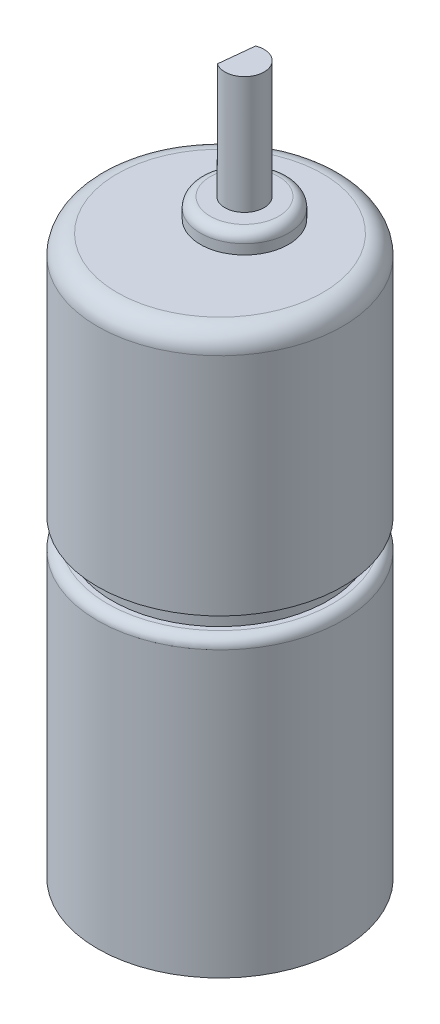
from build123d import *

# Parameters (mm, degrees)
SKETCH1_R           = 12.5
BOSS_EXTRUDE1_DEPTH = 25
SKETCH2_R           = 11
BOSS_EXTRUDE2_DEPTH = 2
BOSS_EXTRUDE3_START = 30
SKETCH3_R           = 12.5
BOSS_EXTRUDE3_DEPTH = 30
SKETCH4_R           = 4.5
BOSS_EXTRUDE4_DEPTH = 2
FILLET1_R           = 2
FILLET2_R           = 1
FILLET3_R           = 1
SKETCH5_R           = 2
BOSS_EXTRUDE5_DEPTH = 12
CUT_EXTRUDE1_START  = -9
CUT_EXTRUDE1_DEPTH  = 9


with BuildPart() as part:
    # Sketch1 → Boss-Extrude1 (new body)
    with BuildSketch(Plane(origin=(0, 0, 0), x_dir=(1, 0, 0), z_dir=(0, 1, 0))):
        with Locations(Location((0, 0, 0), (0, 0, 270))):
            Circle(SKETCH1_R)
    extrude(amount=BOSS_EXTRUDE1_DEPTH)

    # Sketch2 → Boss-Extrude2 (add)
    with BuildSketch(Plane.XZ):
        with Locations(Location((0, 0, 0), (0, 0, 270))):
            Circle(SKETCH2_R)
    extrude(amount=BOSS_EXTRUDE2_DEPTH)

    # Sketch3 → Boss-Extrude3 (add)
    with BuildSketch(Plane.XZ.offset(2).offset(BOSS_EXTRUDE3_START)):
        with Locations(Location((0, 0, 0), (0, 0, 90))):
            Circle(SKETCH3_R)
    extrude(amount=-BOSS_EXTRUDE3_DEPTH)

    # Sketch4 → Boss-Extrude4 (add)
    with BuildSketch(Plane.XZ.offset(-25)):
        with Locations(Location((0, -2.5, 0), (0, 0, 270))):
            Circle(SKETCH4_R)
    extrude(amount=-BOSS_EXTRUDE4_DEPTH)

    # Fillet1
    fillet1_edges = [part.edges().sort_by_distance(p)[0] for p in [
        (0, 25, -12.5),
    ]]
    fillet(fillet1_edges, radius=FILLET1_R)

    # Fillet2
    fillet2_edges = [part.edges().sort_by_distance(p)[0] for p in [
        (0, -2, -12.5),
    ]]
    fillet(fillet2_edges, radius=FILLET2_R)

    # Fillet3
    fillet3_edges = [part.edges().sort_by_distance(p)[0] for p in [
        (0, 27, 2),
    ]]
    fillet(fillet3_edges, radius=FILLET3_R)

    # Sketch5 → Boss-Extrude5 (add)
    with BuildSketch(Plane(origin=(0, 27, 0), x_dir=(1, 0, 0), z_dir=(0, 1, 0))):
        with Locations(Location((0, 2.5, 0), (0, 0, 90))):
            Circle(SKETCH5_R)
    extrude(amount=BOSS_EXTRUDE5_DEPTH)

    # Sketch10 → Cut-Extrude1 (cut)
    with BuildSketch(Plane(origin=(0, 39, 0), x_dir=(1, 0, 0), z_dir=(0, 1, 0)).offset(CUT_EXTRUDE1_START)):
        with BuildLine():
            Line((-0.731515286, 4.361420261), (-1.103703337, 0.832115428))
            ThreePointArc((-1.103703337, 0.832115428), (-1.988970839, 2.709749856), (-0.731515286, 4.361420261))
        make_face()
    extrude(amount=CUT_EXTRUDE1_DEPTH, mode=Mode.SUBTRACT)


solid = part.part
